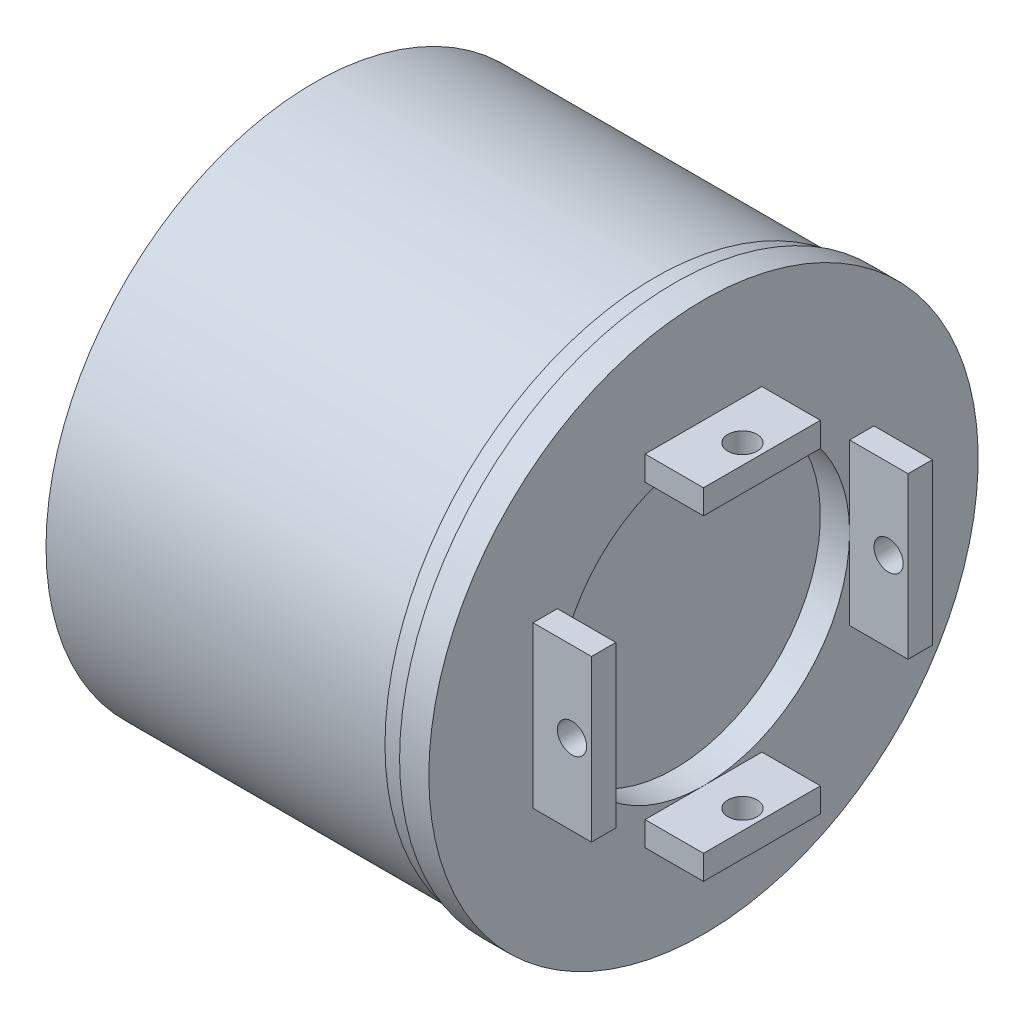
from build123d import *

# Parameters (mm, degrees)
SKETCH_2_R               = 1.5
CUT_EXTRUDE_1_DEPTH      = 8
SKETCH_3_W               = 2.5
SKETCH_3_H               = 16.5
SKETCH_3_W_2             = 12
SKETCH_3_H_2             = 2.5
EXTRUDE_1_DEPTH          = 6
SKETCH_4_R               = 1.5
CUT_EXTRUDE_2_DEPTH      = 50
PATTERN_CIRCULAR_1_COUNT = 2
PATTERN_CIRCULAR_1_ANGLE = 90


with BuildPart() as part:
    # 草图1 → 旋转1 (revolve)
    with BuildSketch(Plane.XY, mode=Mode.PRIVATE) as revolve_1_sk:
        Polygon((1.5, 16.5), (0, 16.5), (0, 16.4), (-2.2, 16.4), (-2.2, 0), (38, 0), (38, 15), (41, 15), (41, 28.2), (38, 28.2), (38, 27.7), (36, 27.7), (36, 27.5), (1, 27.5), (1, 21.5), (1.5, 21.5), align=None)
    revolve(revolve_1_sk.sketch.rotate(Axis((-20.365384615, 0, 0), (1, 0, 0)), 90), axis=Axis((-20.365384615, 0, 0), (1, 0, 0)))

    # 草图2 → 切除-拉伸1 (cut)
    with BuildSketch(Plane.ZY.offset(-1)):
        with Locations((0, 25)):
            Circle(SKETCH_2_R)
        with Locations((21.650635095, -12.5)):
            Circle(SKETCH_2_R)
        with Locations((-21.650635095, -12.5)):
            Circle(SKETCH_2_R)
    extrude(amount=-CUT_EXTRUDE_1_DEPTH, mode=Mode.SUBTRACT)

    # 草图3 → 凸台-拉伸1 (add)
    with BuildSketch(Plane(origin=(41, 0, 0), x_dir=(0, 0, -1), z_dir=(1, 0, 0))):
        with Locations((16.25, 0)):
            Rectangle(SKETCH_3_W, SKETCH_3_H)
        with Locations((0, 16.25)):
            Rectangle(SKETCH_3_W_2, SKETCH_3_H_2)
        with Locations((-16.25, 0)):
            Rectangle(SKETCH_3_W, SKETCH_3_H)
        with Locations((0, -16.25)):
            Rectangle(SKETCH_3_W_2, SKETCH_3_H_2)
    extrude(amount=EXTRUDE_1_DEPTH)

    # 草图4 → 切除-拉伸2 (cut, symmetric)
    with BuildSketch(Plane.XY):
        with Locations((45, 0)):
            Circle(SKETCH_4_R)
    cut_extrude_2 = extrude(amount=CUT_EXTRUDE_2_DEPTH, both=True, mode=Mode.SUBTRACT)

    # 阵列(圆周)1: 切除-拉伸2 ×2 about axis
    pattern_circular_1_axis = Axis((36, 0, 0), (-1, 0, 0))
    for i in range(1, PATTERN_CIRCULAR_1_COUNT):
        add(cut_extrude_2.rotate(pattern_circular_1_axis, i * PATTERN_CIRCULAR_1_ANGLE / (PATTERN_CIRCULAR_1_COUNT - 1)), mode=Mode.SUBTRACT)


solid = part.part
